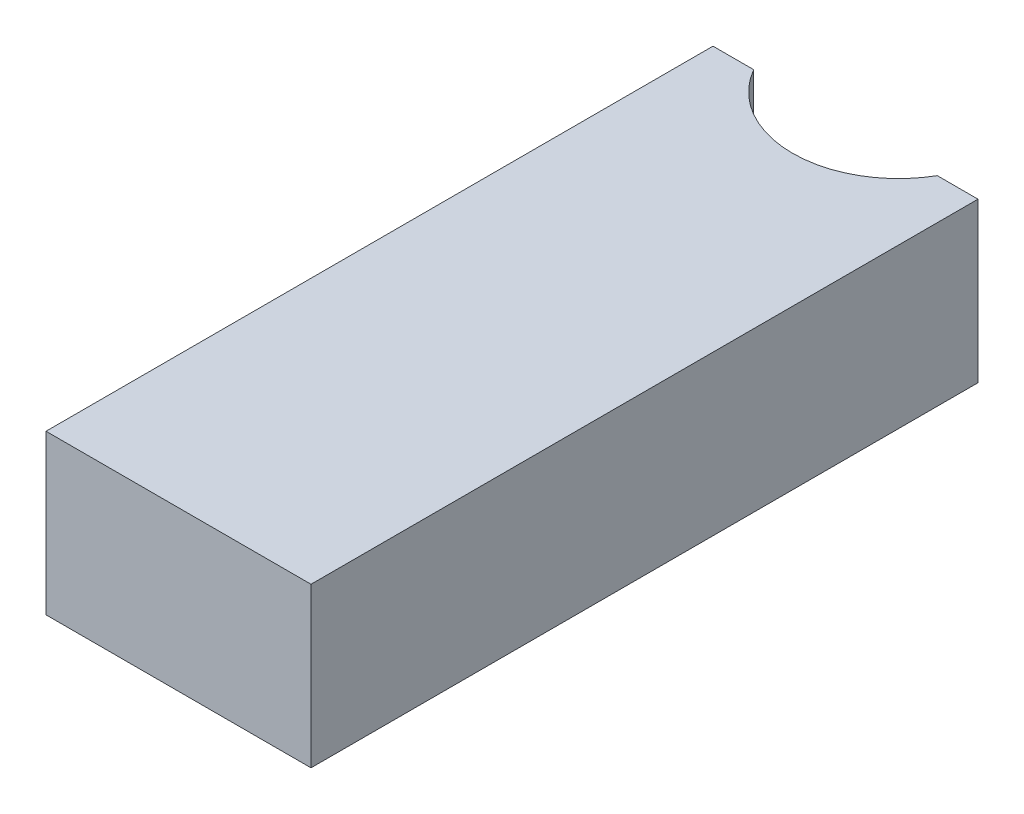
from build123d import *

# Parameters (mm, degrees)
SKETCH1_W           = 31.75
SKETCH1_H           = 19.05
BOSS_EXTRUDE1_DEPTH = 79.9084
SKETCH2_R           = 12.7
CUT_EXTRUDE1_DEPTH  = 84.667619277


with BuildPart() as part:
    # Sketch1 → Boss-Extrude1 (new body)
    with BuildSketch(Plane.XY):
        Rectangle(SKETCH1_W, SKETCH1_H)
    extrude(amount=BOSS_EXTRUDE1_DEPTH)

    # Sketch2 → Cut-Extrude1 (cut, through all)
    with BuildSketch(Plane(origin=(0, 9.525, 0), x_dir=(1, 0, 0), z_dir=(0, 1, 0))):
        with Locations((0, 6.35)):
            Circle(SKETCH2_R)
    extrude(amount=-CUT_EXTRUDE1_DEPTH, mode=Mode.SUBTRACT)


solid = part.part
